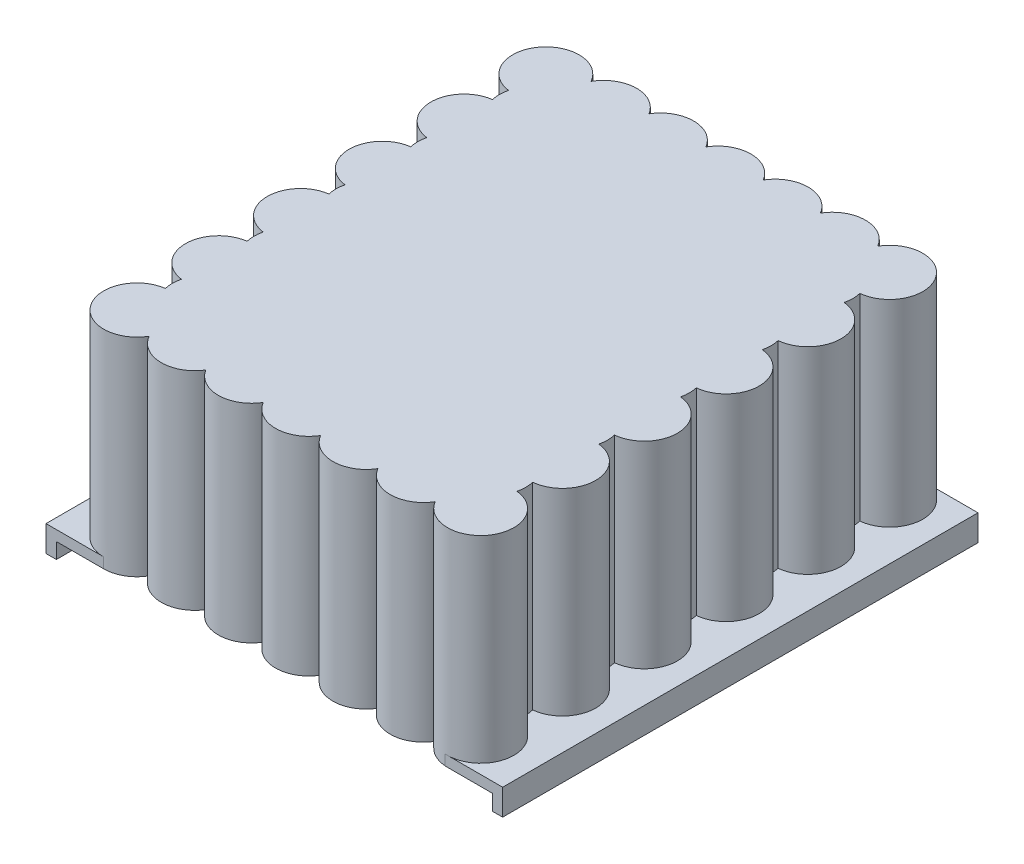
from build123d import *

# Parameters (mm, degrees)
SKETCH3_W           = 266.7
SKETCH3_H           = 304.8
BOSS_EXTRUDE1_DEPTH = 127
SKETCH2_R           = 14
CUT_EXTRUDE1_DEPTH  = 101.6
SKETCH5_W           = 266.7
SKETCH5_H           = 304.8
CUT_EXTRUDE2_DEPTH  = 240.858842452
BOSS_EXTRUDE2_DEPTH = 6.35
SKETCH7_W           = 88.9
SKETCH7_H           = 63.5
BOSS_EXTRUDE4_DEPTH = 6.35
SKETCH10_W          = 6.35
SKETCH10_H          = 290.83
BOSS_EXTRUDE5_DEPTH = 9.525


with BuildPart() as part:
    # Sketch3 → Boss-Extrude1 (new body)
    with BuildSketch(Plane(origin=(0, 0, 0), x_dir=(1, 0, 0), z_dir=(0, 1, 0))):
        with Locations((1.030211855, 0.391436162)):
            Rectangle(SKETCH3_W, SKETCH3_H)
    extrude(amount=BOSS_EXTRUDE1_DEPTH)

    # Sketch2 → Cut-Extrude1 (cut)
    with BuildSketch(Plane(origin=(0, 0, 0), x_dir=(1, 0, 0), z_dir=(0, 1, 0))):
        with Locations(Location((-104.384517455, 125.341266146, 0), (0, 0, 270))):
            Circle(SKETCH2_R)
        with Locations(Location((-69.384517455, 125.341266146, 0), (0, 0, 270))):
            Circle(SKETCH2_R)
        with Locations(Location((-34.384517455, 125.341266146, 0), (0, 0, 270))):
            Circle(SKETCH2_R)
        with Locations(Location((0.615482545, 125.341266146, 0), (0, 0, 270))):
            Circle(SKETCH2_R)
        with Locations(Location((35.615482545, 125.341266146, 0), (0, 0, 270))):
            Circle(SKETCH2_R)
        with Locations(Location((70.615482545, 125.341266146, 0), (0, 0, 270))):
            Circle(SKETCH2_R)
        with Locations(Location((105.615482545, 125.341266146, 0), (0, 0, 270))):
            Circle(SKETCH2_R)
        with Locations(Location((-69.384517455, 75.341266146, 0), (0, 0, 270))):
            Circle(SKETCH2_R)
        with Locations(Location((-34.384517455, 75.341266146, 0), (0, 0, 270))):
            Circle(SKETCH2_R)
        with Locations(Location((0.615482545, 75.341266146, 0), (0, 0, 270))):
            Circle(SKETCH2_R)
        with Locations(Location((35.615482545, 75.341266146, 0), (0, 0, 270))):
            Circle(SKETCH2_R)
        with Locations(Location((70.615482545, 75.341266146, 0), (0, 0, 270))):
            Circle(SKETCH2_R)
        with Locations(Location((105.615482545, 75.341266146, 0), (0, 0, 270))):
            Circle(SKETCH2_R)
        with Locations(Location((-69.384517455, 25.341266146, 0), (0, 0, 270))):
            Circle(SKETCH2_R)
        with Locations(Location((-34.384517455, 25.341266146, 0), (0, 0, 270))):
            Circle(SKETCH2_R)
        with Locations(Location((0.615482545, 25.341266146, 0), (0, 0, 270))):
            Circle(SKETCH2_R)
        with Locations(Location((35.615482545, 25.341266146, 0), (0, 0, 270))):
            Circle(SKETCH2_R)
        with Locations(Location((70.615482545, 25.341266146, 0), (0, 0, 270))):
            Circle(SKETCH2_R)
        with Locations(Location((105.615482545, 25.341266146, 0), (0, 0, 270))):
            Circle(SKETCH2_R)
        with Locations(Location((-69.384517455, -24.658733854, 0), (0, 0, 270))):
            Circle(SKETCH2_R)
        with Locations(Location((-34.384517455, -24.658733854, 0), (0, 0, 270))):
            Circle(SKETCH2_R)
        with Locations(Location((0.615482545, -24.658733854, 0), (0, 0, 270))):
            Circle(SKETCH2_R)
        with Locations(Location((35.615482545, -24.658733854, 0), (0, 0, 270))):
            Circle(SKETCH2_R)
        with Locations(Location((70.615482545, -24.658733854, 0), (0, 0, 270))):
            Circle(SKETCH2_R)
        with Locations(Location((105.615482545, -24.658733854, 0), (0, 0, 270))):
            Circle(SKETCH2_R)
        with Locations(Location((-69.384517455, -74.658733854, 0), (0, 0, 270))):
            Circle(SKETCH2_R)
        with Locations(Location((-34.384517455, -74.658733854, 0), (0, 0, 270))):
            Circle(SKETCH2_R)
        with Locations(Location((0.615482545, -74.658733854, 0), (0, 0, 270))):
            Circle(SKETCH2_R)
        with Locations(Location((35.615482545, -74.658733854, 0), (0, 0, 270))):
            Circle(SKETCH2_R)
        with Locations(Location((70.615482545, -74.658733854, 0), (0, 0, 270))):
            Circle(SKETCH2_R)
        with Locations(Location((105.615482545, -74.658733854, 0), (0, 0, 270))):
            Circle(SKETCH2_R)
        with Locations(Location((-69.384517455, -124.658733854, 0), (0, 0, 270))):
            Circle(SKETCH2_R)
        with Locations(Location((-34.384517455, -124.658733854, 0), (0, 0, 270))):
            Circle(SKETCH2_R)
        with Locations(Location((0.615482545, -124.658733854, 0), (0, 0, 270))):
            Circle(SKETCH2_R)
        with Locations(Location((35.615482545, -124.658733854, 0), (0, 0, 270))):
            Circle(SKETCH2_R)
        with Locations(Location((70.615482545, -124.658733854, 0), (0, 0, 270))):
            Circle(SKETCH2_R)
        with Locations(Location((105.615482545, -124.658733854, 0), (0, 0, 270))):
            Circle(SKETCH2_R)
        with Locations(Location((-104.384517455, 75.341266146, 0), (0, 0, 270))):
            Circle(SKETCH2_R)
        with Locations(Location((-104.384517455, 25.341266146, 0), (0, 0, 270))):
            Circle(SKETCH2_R)
        with Locations(Location((-104.384517455, -24.658733854, 0), (0, 0, 270))):
            Circle(SKETCH2_R)
        with Locations(Location((-104.384517455, -74.658733854, 0), (0, 0, 270))):
            Circle(SKETCH2_R)
        with Locations(Location((-104.384517455, -124.658733854, 0), (0, 0, 270))):
            Circle(SKETCH2_R)
        with Locations(Location((-87.384517455, 100.341266146, 0), (0, 0, 270))):
            Circle(SKETCH2_R)
        with Locations(Location((-52.384517455, 100.341266146, 0), (0, 0, 270))):
            Circle(SKETCH2_R)
        with Locations(Location((-17.384517455, 100.341266146, 0), (0, 0, 270))):
            Circle(SKETCH2_R)
        with Locations(Location((17.615482545, 100.341266146, 0), (0, 0, 270))):
            Circle(SKETCH2_R)
        with Locations(Location((52.615482545, 100.341266146, 0), (0, 0, 270))):
            Circle(SKETCH2_R)
        with Locations(Location((87.615482545, 100.341266146, 0), (0, 0, 270))):
            Circle(SKETCH2_R)
        with Locations(Location((-52.384517455, 50.341266146, 0), (0, 0, 270))):
            Circle(SKETCH2_R)
        with Locations(Location((-17.384517455, 50.341266146, 0), (0, 0, 270))):
            Circle(SKETCH2_R)
        with Locations(Location((17.615482545, 50.341266146, 0), (0, 0, 270))):
            Circle(SKETCH2_R)
        with Locations(Location((52.615482545, 50.341266146, 0), (0, 0, 270))):
            Circle(SKETCH2_R)
        with Locations(Location((87.615482545, 50.341266146, 0), (0, 0, 270))):
            Circle(SKETCH2_R)
        with Locations(Location((-52.384517455, 0.341266146, 0), (0, 0, 270))):
            Circle(SKETCH2_R)
        with Locations(Location((-17.384517455, 0.341266146, 0), (0, 0, 270))):
            Circle(SKETCH2_R)
        with Locations(Location((17.615482545, 0.341266146, 0), (0, 0, 270))):
            Circle(SKETCH2_R)
        with Locations(Location((52.615482545, 0.341266146, 0), (0, 0, 270))):
            Circle(SKETCH2_R)
        with Locations(Location((87.615482545, 0.341266146, 0), (0, 0, 270))):
            Circle(SKETCH2_R)
        with Locations(Location((-52.384517455, -49.658733854, 0), (0, 0, 270))):
            Circle(SKETCH2_R)
        with Locations(Location((-17.384517455, -49.658733854, 0), (0, 0, 270))):
            Circle(SKETCH2_R)
        with Locations(Location((17.615482545, -49.658733854, 0), (0, 0, 270))):
            Circle(SKETCH2_R)
        with Locations(Location((52.615482545, -49.658733854, 0), (0, 0, 270))):
            Circle(SKETCH2_R)
        with Locations(Location((87.615482545, -49.658733854, 0), (0, 0, 270))):
            Circle(SKETCH2_R)
        with Locations(Location((-52.384517455, -99.658733854, 0), (0, 0, 270))):
            Circle(SKETCH2_R)
        with Locations(Location((-17.384517455, -99.658733854, 0), (0, 0, 270))):
            Circle(SKETCH2_R)
        with Locations(Location((17.615482545, -99.658733854, 0), (0, 0, 270))):
            Circle(SKETCH2_R)
        with Locations(Location((52.615482545, -99.658733854, 0), (0, 0, 270))):
            Circle(SKETCH2_R)
        with Locations(Location((87.615482545, -99.658733854, 0), (0, 0, 270))):
            Circle(SKETCH2_R)
        with Locations(Location((-87.384517455, 50.341266146, 0), (0, 0, 270))):
            Circle(SKETCH2_R)
        with Locations(Location((-87.384517455, 0.341266146, 0), (0, 0, 270))):
            Circle(SKETCH2_R)
        with Locations(Location((-87.384517455, -49.658733854, 0), (0, 0, 270))):
            Circle(SKETCH2_R)
        with Locations(Location((-87.384517455, -99.658733854, 0), (0, 0, 270))):
            Circle(SKETCH2_R)
    extrude(amount=CUT_EXTRUDE1_DEPTH, mode=Mode.SUBTRACT)

    # Sketch5 → Cut-Extrude2 (cut, through all)
    with BuildSketch(Plane.XZ):
        with Locations((1.030211855, -0.391436162)):
            Rectangle(SKETCH5_W, SKETCH5_H)
        with BuildLine():
            ThreePointArc((-86.775223532, 134.798515287), (-121.25188109, 135.98986107), (-107.113753094, 104.522853619))
            ThreePointArc((-107.113753094, 104.522853619), (-107.704508629, 99.639794762), (-107.104651694, 94.757845606))
            ThreePointArc((-107.104651694, 94.757845606), (-124.704516936, 74.625326024), (-107.113753094, 54.484853619))
            ThreePointArc((-107.113753094, 54.484853619), (-107.704508629, 49.601794762), (-107.104651694, 44.719845606))
            ThreePointArc((-107.104651694, 44.719845606), (-124.704516936, 24.587326024), (-107.113753094, 4.446853619))
            ThreePointArc((-107.113753094, 4.446853619), (-107.704508629, -0.436205238), (-107.104651694, -5.318154394))
            ThreePointArc((-107.104651694, -5.318154394), (-124.704516936, -25.450673976), (-107.113753094, -45.591146381))
            ThreePointArc((-107.113753094, -45.591146381), (-107.704508629, -50.474205238), (-107.104651694, -55.356154394))
            ThreePointArc((-107.104651694, -55.356154394), (-124.704516936, -75.488673976), (-107.113753094, -95.629146381))
            ThreePointArc((-107.113753094, -95.629146381), (-107.704508629, -100.512205238), (-107.104651694, -105.394154394))
            ThreePointArc((-107.104651694, -105.394154394), (-121.162990751, -136.993605954), (-86.614743522, -135.387103725))
            ThreePointArc((-86.614743522, -135.387103725), (-69.332292243, -145.712785219), (-51.719624887, -135.961027984))
            ThreePointArc((-51.719624887, -135.961027984), (-34.195273648, -145.851087344), (-16.754517455, -135.814345646))
            ThreePointArc((-16.754517455, -135.814345646), (0.771482545, -145.851266146), (18.297482545, -135.814345646))
            ThreePointArc((18.297482545, -135.814345646), (35.823482545, -145.851266146), (53.349482545, -135.814345646))
            ThreePointArc((53.349482545, -135.814345646), (70.875482545, -145.851266146), (88.401482545, -135.814345646))
            ThreePointArc((88.401482545, -135.814345646), (123.036065237, -136.4947874), (107.948012416, -105.311971919))
            ThreePointArc((107.948012416, -105.311971919), (108.527626689, -100.51235477), (107.957030963, -95.711657112))
            ThreePointArc((107.957030963, -95.711657112), (126.247482039, -75.488734313), (107.948012416, -55.273971919))
            ThreePointArc((107.948012416, -55.273971919), (108.527626689, -50.47435477), (107.957030963, -45.673657112))
            ThreePointArc((107.957030963, -45.673657112), (126.247482039, -25.450734313), (107.948012416, -5.235971919))
            ThreePointArc((107.948012416, -5.235971919), (108.527626689, -0.43635477), (107.957030963, 4.364342888))
            ThreePointArc((107.957030963, 4.364342888), (126.247482039, 24.587265687), (107.948012416, 44.802028081))
            ThreePointArc((107.948012416, 44.802028081), (108.527626689, 49.60164523), (107.957030963, 54.402342888))
            ThreePointArc((107.957030963, 54.402342888), (126.247482039, 74.625265687), (107.948012416, 94.840028081))
            ThreePointArc((107.948012416, 94.840028081), (108.527626689, 99.63964523), (107.957030963, 104.440342888))
            ThreePointArc((107.957030963, 104.440342888), (123.03361969, 135.626070448), (88.401482545, 134.941813353))
            ThreePointArc((88.401482545, 134.941813353), (70.875482545, 144.978733854), (53.349482545, 134.941813353))
            ThreePointArc((53.349482545, 134.941813353), (35.823482545, 144.978733854), (18.297482545, 134.941813353))
            ThreePointArc((18.297482545, 134.941813353), (0.771482545, 144.978733854), (-16.754517455, 134.941813353))
            ThreePointArc((-16.754517455, 134.941813353), (-34.037988271, 144.97728645), (-51.556074361, 135.357216624))
            ThreePointArc((-51.556074361, 135.357216624), (-69.32494992, 145.119804961), (-86.775223532, 134.798515287))
        make_face(mode=Mode.SUBTRACT)
    extrude(amount=-CUT_EXTRUDE2_DEPTH, mode=Mode.SUBTRACT)

    # Sketch6 → Boss-Extrude2 (add)
    with BuildSketch(Plane.XZ):
        with BuildLine():
            Line((-104.384517455, 144.978733854), (-139.7, 144.978733854))
            Line((-139.7, 144.978733854), (-139.7, -145.851266146))
            Line((-139.7, -145.851266146), (-104.384517455, -145.851266146))
            ThreePointArc((-104.384517455, -145.851266146), (-124.658743838, -126.894403923), (-107.104651694, -105.394154394))
            ThreePointArc((-107.104651694, -105.394154394), (-107.704508629, -100.512205238), (-107.113753094, -95.629146381))
            ThreePointArc((-107.113753094, -95.629146381), (-124.704516936, -75.488673976), (-107.104651694, -55.356154394))
            ThreePointArc((-107.104651694, -55.356154394), (-107.704508629, -50.474205238), (-107.113753094, -45.591146381))
            ThreePointArc((-107.113753094, -45.591146381), (-124.704516936, -25.450673976), (-107.104651694, -5.318154394))
            ThreePointArc((-107.104651694, -5.318154394), (-107.704508629, -0.436205238), (-107.113753094, 4.446853619))
            ThreePointArc((-107.113753094, 4.446853619), (-124.704516936, 24.587326024), (-107.104651694, 44.719845606))
            ThreePointArc((-107.104651694, 44.719845606), (-107.704508629, 49.601794762), (-107.113753094, 54.484853619))
            ThreePointArc((-107.113753094, 54.484853619), (-124.704516936, 74.625326024), (-107.104651694, 94.757845606))
            ThreePointArc((-107.104651694, 94.757845606), (-107.704508629, 99.639794762), (-107.113753094, 104.522853619))
            ThreePointArc((-107.113753094, 104.522853619), (-124.658435261, 126.026453421), (-104.384517455, 144.978733854))
        make_face()
    boss_extrude2 = extrude(amount=-BOSS_EXTRUDE2_DEPTH)

    # Mirror2: Boss-Extrude2 across plane
    add(boss_extrude2.mirror(Plane(origin=(0, 0, 0), x_dir=(0, 0, 1), z_dir=(1, 0, 0))))

    # Sketch10 → Boss-Extrude5 (add)
    with BuildSketch(Plane.XZ):
        with Locations((-136.525, -0.436266146)):
            Rectangle(SKETCH10_W, SKETCH10_H)
    boss_extrude5 = extrude(amount=BOSS_EXTRUDE5_DEPTH)

    # Mirror3: Boss-Extrude5 across plane
    add(boss_extrude5.mirror(Plane(origin=(0, 0, 0), x_dir=(0, 0, 1), z_dir=(1, 0, 0))))


with BuildPart() as body_2:
    # Sketch7 → Boss-Extrude4 (new body)
    with BuildSketch(Plane(origin=(0, 0, -145.851266146), x_dir=(-1, 0, 0), z_dir=(0, 0, -1))):
        with Locations((0, 57.15)):
            Rectangle(SKETCH7_W, SKETCH7_H)
    extrude(amount=BOSS_EXTRUDE4_DEPTH)


solid = Compound([part.part, body_2.part])
